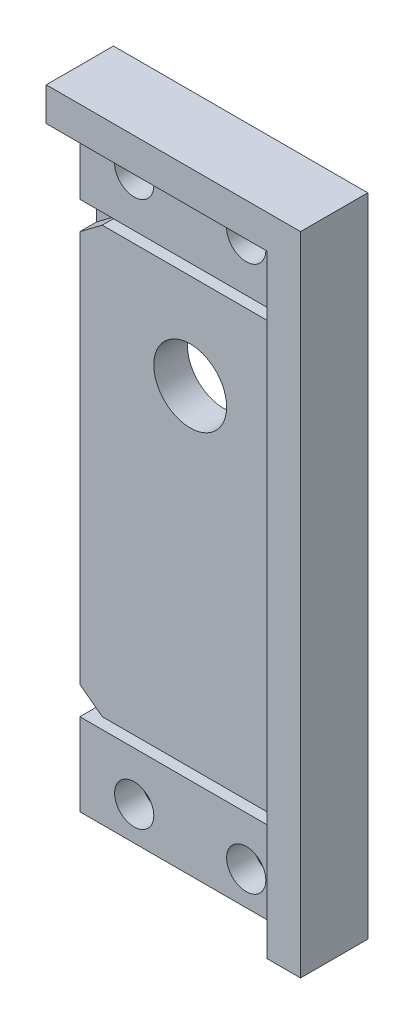
from build123d import *

# Parameters (mm, degrees)
CROQUIS1_W              = 19.7
CROQUIS1_H              = 54.7
CROQUIS1_R              = 1.75
SALIENTE_EXTRUIR1_DEPTH = 3
CHAFL_N1_SIZE           = 0.6
CORTAR_EXTRUIR1_DEPTH   = 1.5
CROQUIS3_R              = 3.25
CORTAR_EXTRUIR2_DEPTH   = 30.224048316
SALIENTE_EXTRUIR2_DEPTH = 6


with BuildPart() as part:
    # Croquis1 → Saliente-Extruir1 (new body)
    with BuildSketch(Plane.XY):
        Rectangle(CROQUIS1_W, CROQUIS1_H)
        with Locations((-5, -24.35)):
            Circle(CROQUIS1_R, mode=Mode.SUBTRACT)
        with Locations((5, -24.35)):
            Circle(CROQUIS1_R, mode=Mode.SUBTRACT)
        with Locations(Location((5, 24.35, 0), (0, 0, 180))):
            Circle(CROQUIS1_R, mode=Mode.SUBTRACT)
        with Locations(Location((-5, 24.35, 0), (0, 0, 180))):
            Circle(CROQUIS1_R, mode=Mode.SUBTRACT)
    extrude(amount=SALIENTE_EXTRUIR1_DEPTH)

    # Chaflán1
    chafl_n1_edges = [part.edges().sort_by_distance(p)[0] for p in [
        (-6.75, -24.35, 0),
        (3.25, -24.35, 0),
        (6.75, 24.35, 0),
        (-3.25, 24.35, 0),
    ]]
    chamfer(chafl_n1_edges, length=CHAFL_N1_SIZE)

    # Croquis2 → Cortar-Extruir1 (cut)
    with BuildSketch(Plane.XY.offset(3)):
        Polygon((9.85, 20), (-9.85, 20), (-9.85, 17.5), (-7.85, 19), (7.85, 19), (9.85, 17.5), align=None)
        Polygon((-7.85, -19), (-9.85, -17.5), (-9.85, -20), (9.85, -20), (9.85, -17.5), (7.85, -19), align=None)
    extrude(amount=-CORTAR_EXTRUIR1_DEPTH, mode=Mode.SUBTRACT)

    # Croquis3 → Cortar-Extruir2 (cut, through all)
    with BuildSketch(Plane.XY.offset(3)):
        with Locations((0, 10.5)):
            Circle(CROQUIS3_R)
    extrude(amount=-CORTAR_EXTRUIR2_DEPTH, mode=Mode.SUBTRACT)

    # Croquis4 → Saliente-Extruir2 (add)
    with BuildSketch(Plane(origin=(0, 0, 0), x_dir=(-1, 0, 0), z_dir=(0, 0, -1))):
        Polygon((-9.85, -27.35), (-12.85, -27.35), (-12.85, 30.35), (9.85, 30.35), (9.85, 27.35), (-9.85, 27.35), align=None)
    extrude(amount=-SALIENTE_EXTRUIR2_DEPTH)


solid = part.part
